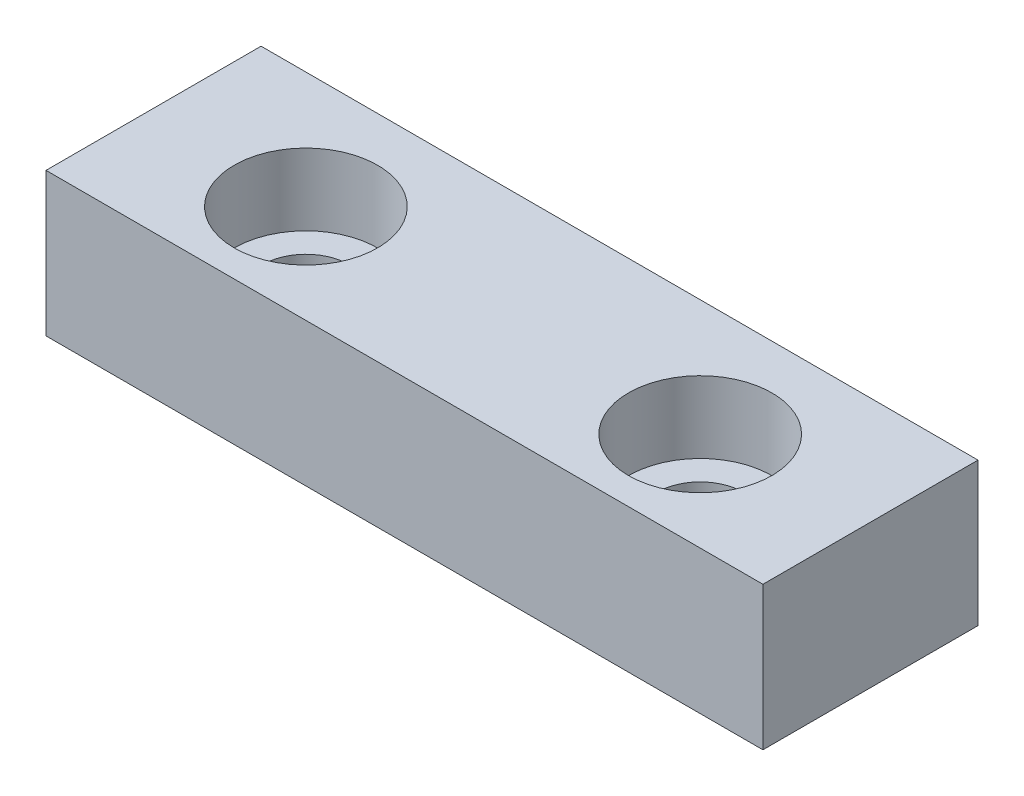
from build123d import *

# Parameters (mm, degrees)
SKETCH_1_W                   = 40
SKETCH_1_H                   = 8
EXTRUDE_1_DEPTH              = 12
HOLE_WIZARD_M4_3_D           = 4.8
HOLE_WIZARD_M4_3_CBORE_D     = 8
HOLE_WIZARD_M4_3_CBORE_DEPTH = 4


with BuildPart() as part:
    # 草图1 → 凸台-拉伸1 (new body)
    with BuildSketch(Plane.XY):
        with Locations((20, 4)):
            Rectangle(SKETCH_1_W, SKETCH_1_H)
    extrude(amount=EXTRUDE_1_DEPTH)

    # M4 六角凹头螺钉的柱形沉头孔3 (through all)
    with Locations(Plane(origin=(0, 8, 0), x_dir=(-1, 0, 0), z_dir=(0, 1, 0))):
        with Locations((-9, 6.5), (-31, 6.5)):
            CounterBoreHole(HOLE_WIZARD_M4_3_D / 2, HOLE_WIZARD_M4_3_CBORE_D / 2, HOLE_WIZARD_M4_3_CBORE_DEPTH)


solid = part.part
